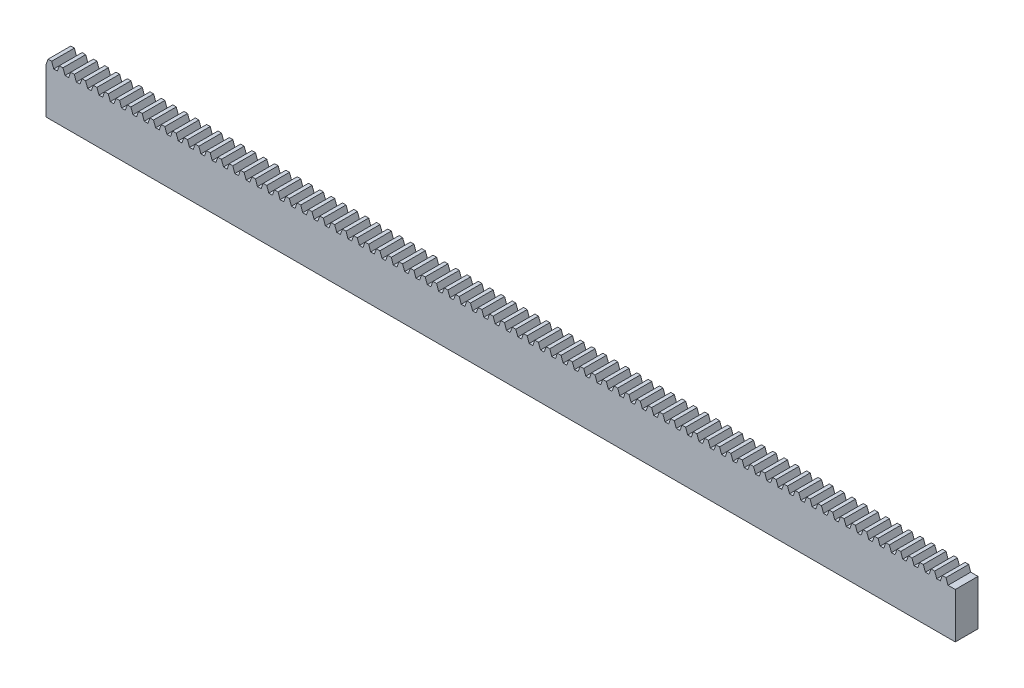
from build123d import *

# Parameters (mm, degrees)
SKETCH_1_W             = 200
SKETCH_1_H             = 10
EXTRUDE_1_DEPTH        = 5
EXTRUDE_2_DEPTH        = 5
PATTERN_LINEAR_1_COUNT = 80
PATTERN_LINEAR_1_PITCH = 2.49


with BuildPart() as part:
    # 草图1 → 拉伸1 (new body)
    with BuildSketch(Plane.XY):
        with Locations((100, -5)):
            Rectangle(SKETCH_1_W, SKETCH_1_H)
    extrude(amount=EXTRUDE_1_DEPTH)

    # 草图2 → 拉伸2 (add)
    with BuildSketch(Plane.XY.offset(5)):
        Polygon((0.454962793, 1.25), (0, 0), (1.695323749, 0), (1.240360956, 1.25), align=None)
    extrude_2 = extrude(amount=-EXTRUDE_2_DEPTH)

    # 阵列(线性)1: 拉伸2 ×80
    with Locations(*[(i * PATTERN_LINEAR_1_PITCH, 0, 0) for i in range(1, PATTERN_LINEAR_1_COUNT)]):
        add(extrude_2)


solid = part.part
